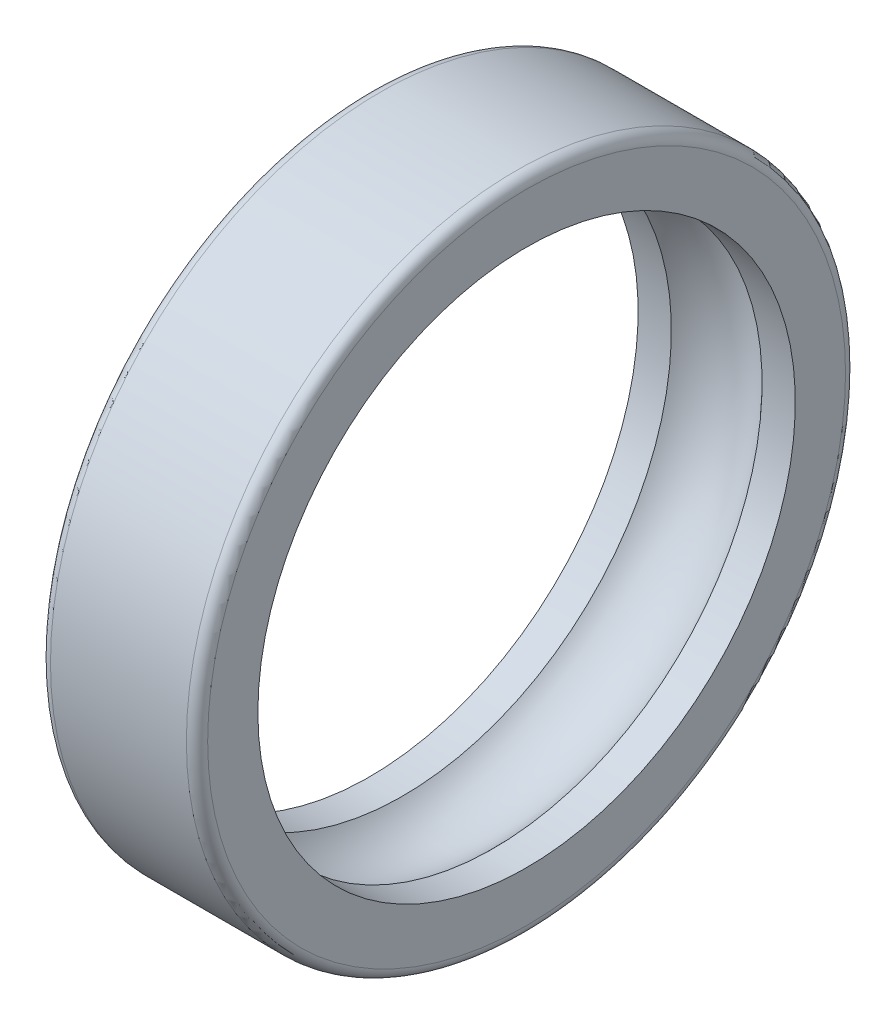
from build123d import *

# Parameters (mm, degrees)
FILLET1_R = 2.1


with BuildPart() as part:
    # Sketch1 → Revolve1 (revolve)
    with BuildSketch(Plane.XY, mode=Mode.PRIVATE) as revolve1_sk:
        with BuildLine():
            Line((-15.5, 65), (15.5, 65))
            Line((15.5, 65), (15.5, 53))
            Line((15.5, 53), (8.94427191, 53))
            ThreePointArc((8.94427191, 53), (0, 57), (-8.94427191, 53))
            Line((-8.94427191, 53), (-15.5, 53))
            Line((-15.5, 53), (-15.5, 65))
        make_face()
    revolve(revolve1_sk.sketch.rotate(Axis((-45.26660281, 0, 0), (1, 0, 0)), 90), axis=Axis((-45.26660281, 0, 0), (1, 0, 0)))

    # Fillet1
    fillet1_edges = [part.edges().sort_by_distance(p)[0] for p in [
        (-15.5, 0, -65),
        (15.5, 0, -65),
    ]]
    fillet(fillet1_edges, radius=FILLET1_R)


solid = part.part
